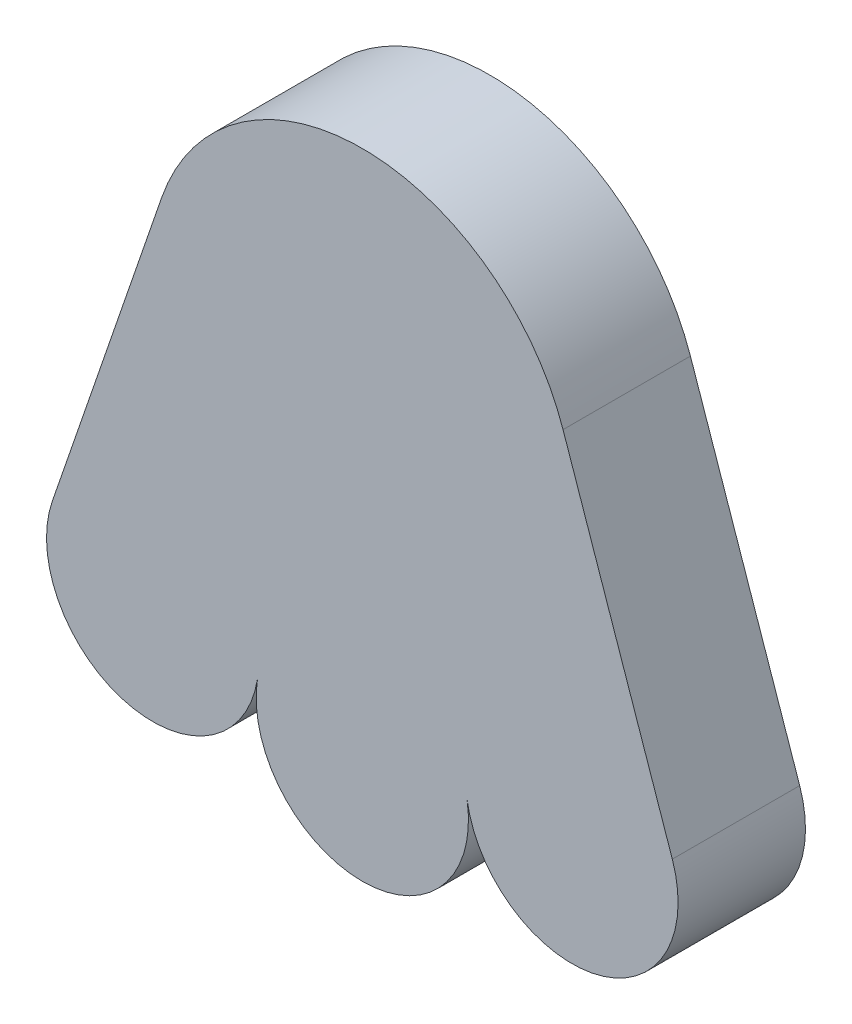
from build123d import *

# Parameters (mm, degrees)
SALIENTE_EXTRUIR1_DEPTH = 3


with BuildPart() as part:
    # Croquis1 → Saliente-Extruir1 (new body)
    with BuildSketch(Plane.XY):
        with BuildLine():
            Line((-4.727593517, 4.627838916), (-7.301146697, -2.846311758))
            ThreePointArc((-7.301146697, -2.846311758), (-5.543839597, -6.085549813), (-2.468674969, -4.054748512))
            ThreePointArc((-2.468674969, -4.054748512), (0, -6.949265807), (2.468674969, -4.054748512))
            ThreePointArc((2.468674969, -4.054748512), (5.543839597, -6.085549813), (7.301146697, -2.846311758))
            Line((7.301146697, -2.846311758), (4.727593517, 4.627838916))
            ThreePointArc((4.727593517, 4.627838916), (0, 8), (-4.727593517, 4.627838916))
        make_face()
    extrude(amount=SALIENTE_EXTRUIR1_DEPTH)


solid = part.part
